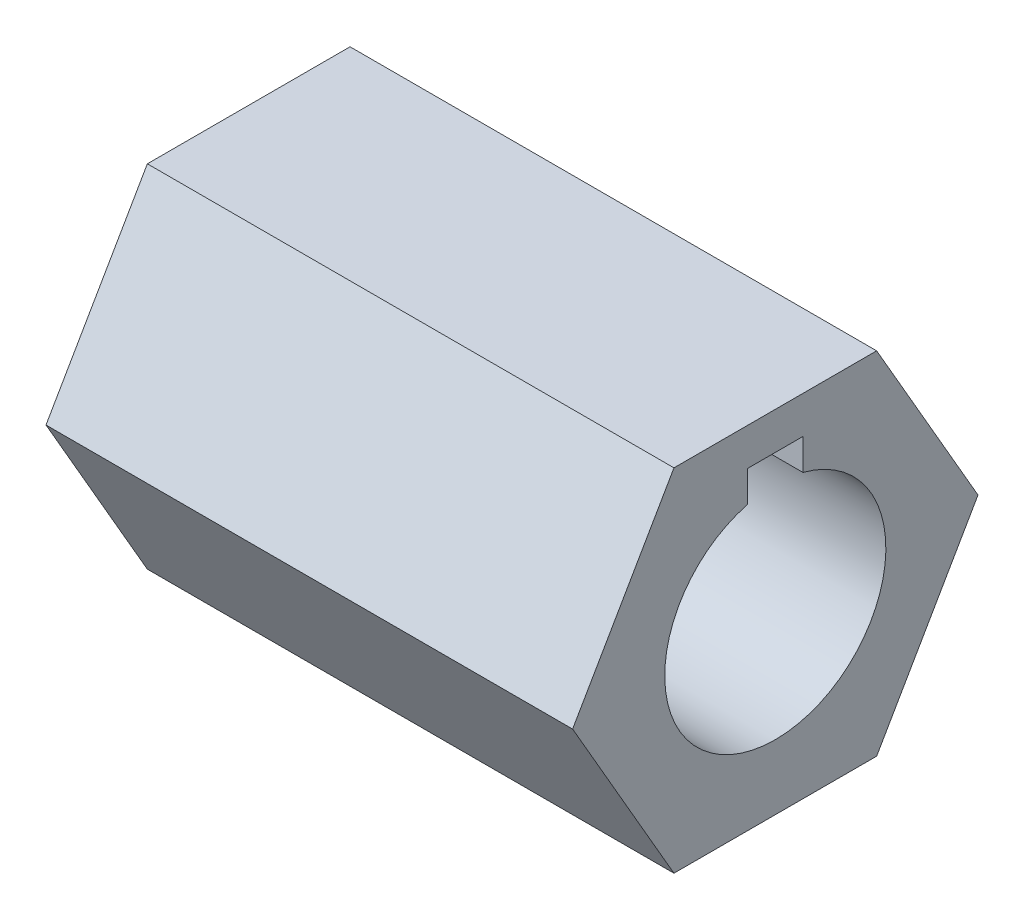
from build123d import *

# Parameters (mm, degrees)
BOSS_EXTRUDE1_DEPTH = 19.05
CUT_EXTRUDE1_DEPTH  = 22.377285453


with BuildPart() as part:
    # Sketch1 → Boss-Extrude1 (new body)
    with BuildSketch(Plane(origin=(0, 0, 0), x_dir=(0, 0, -1), z_dir=(1, 0, 0))):
        Polygon((7.332348419, 0), (3.666174209, 6.35), (-3.666174209, 6.35), (-7.332348419, 0), (-3.666174209, -6.35), (3.666174209, -6.35), align=None)
    extrude(amount=BOSS_EXTRUDE1_DEPTH)

    # Sketch2 → Cut-Extrude1 (cut, through all)
    with BuildSketch(Plane(origin=(19.05, 0, 0), x_dir=(0, 0, -1), z_dir=(1, 0, 0))):
        with BuildLine():
            ThreePointArc((-1, 3.872983346), (0, 4), (1, 3.872983346))
            Line((1, 3.872983346), (1, 5))
            Line((1, 5), (-1, 5))
            Line((-1, 5), (-1, 3.872983346))
        make_face()
        with BuildLine():
            Line((1, 3.872983346), (1, 3))
            Line((1, 3), (-1, 3))
            Line((-1, 3), (-1, 3.872983346))
            ThreePointArc((-1, 3.872983346), (-2.449489743, -3.16227766), (4, 0))
            ThreePointArc((4, 0), (3.16227766, 2.449489743), (1, 3.872983346))
        make_face()
        with BuildLine():
            Line((-1, 3), (1, 3))
            Line((1, 3), (1, 3.872983346))
            ThreePointArc((1, 3.872983346), (0, 4), (-1, 3.872983346))
            Line((-1, 3.872983346), (-1, 3))
        make_face()
    extrude(amount=-CUT_EXTRUDE1_DEPTH, mode=Mode.SUBTRACT)


solid = part.part
